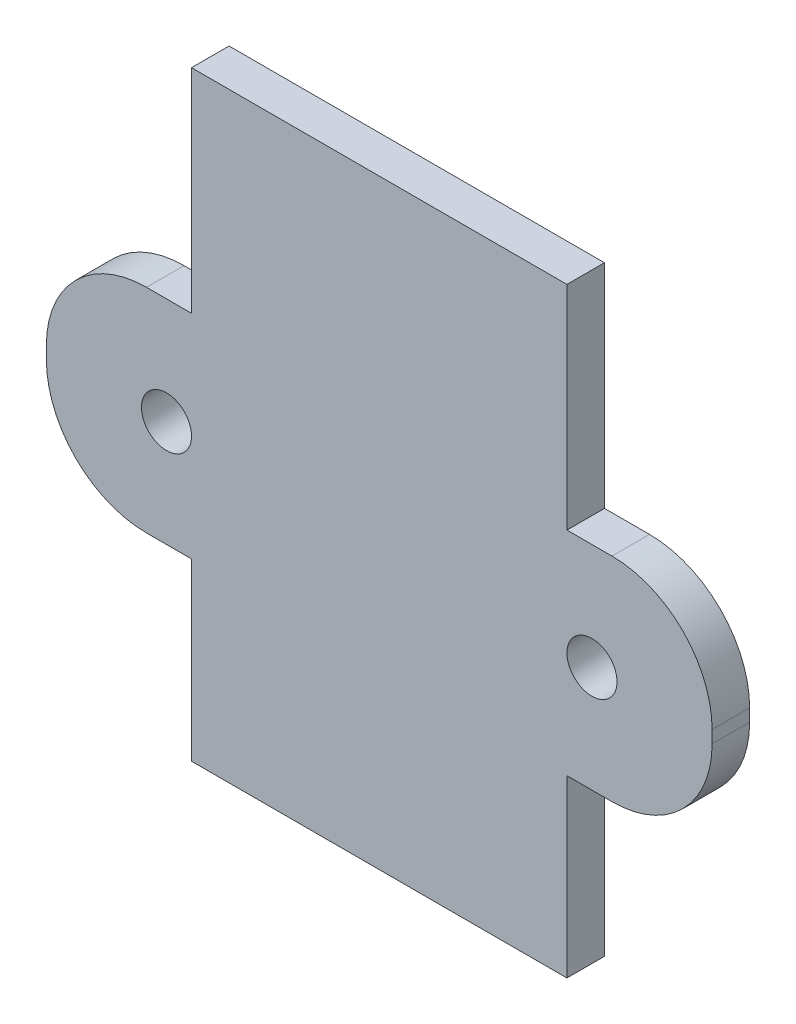
from build123d import *

# Parameters (mm, degrees)
ESBO_O2_W                = 28.244172386
ESBO_O2_H                = 13.944205314
RESSALTO_EXTRUS_O1_DEPTH = 2.54
ESBO_O3_R                = 1
RESSALTO_EXTRUS_O2_DEPTH = 1.5
ESBO_O4_W                = 28.244172386
ESBO_O4_H                = 13.944205314
CORTE_EXTRUS_O1_DEPTH    = 2.54


with BuildPart() as part:
    # Esboço2 → Ressalto-extrusão1 (new body)
    with BuildSketch(Plane.XY):
        Rectangle(ESBO_O2_W, ESBO_O2_H)
    extrude(amount=RESSALTO_EXTRUS_O1_DEPTH)

    # Esboço4 → Corte-extrusão1 (cut)
    with BuildSketch(Plane.XY.offset(2.54)):
        Rectangle(ESBO_O4_W, ESBO_O4_H)
    extrude(amount=-CORTE_EXTRUS_O1_DEPTH, mode=Mode.SUBTRACT)


with BuildPart() as body_2:
    # Esboço3 → Ressalto-extrusão2 (new body)
    with BuildSketch(Plane.XY):
        with BuildLine():
            Line((-40.638175932, 11.952156585), (-40.638175932, 3.452156585))
            Line((-40.638175932, 3.452156585), (-42.438175932, 3.452156585))
            ThreePointArc((-42.438175932, 3.452156585), (-45.266603057, 2.28058371), (-46.438175932, -0.547843415))
            Line((-46.438175932, -0.547843415), (-46.438175932, -1.047843415))
            ThreePointArc((-46.438175932, -1.047843415), (-45.266603057, -3.876270539), (-42.438175932, -5.047843415))
            Line((-42.438175932, -5.047843415), (-40.638175932, -5.047843415))
            Line((-40.638175932, -5.047843415), (-40.638175932, -12.047843415))
            Line((-40.638175932, -12.047843415), (-25.638175932, -12.047843415))
            Line((-25.638175932, -12.047843415), (-25.638175932, -5.047843415))
            Line((-25.638175932, -5.047843415), (-23.838175932, -5.047843415))
            ThreePointArc((-23.838175932, -5.047843415), (-21.009748807, -3.876270539), (-19.838175932, -1.047843415))
            Line((-19.838175932, -1.047843415), (-19.838175932, -0.547843415))
            ThreePointArc((-19.838175932, -0.547843415), (-21.009748807, 2.28058371), (-23.838175932, 3.452156585))
            Line((-23.838175932, 3.452156585), (-25.638175932, 3.452156585))
            Line((-25.638175932, 3.452156585), (-25.638175932, 11.952156585))
            Line((-25.638175932, 11.952156585), (-40.638175932, 11.952156585))
        make_face()
        with Locations((-41.638175932, -0.797843415)):
            Circle(ESBO_O3_R, mode=Mode.SUBTRACT)
        with Locations((-24.638175932, -0.797843415)):
            Circle(ESBO_O3_R, mode=Mode.SUBTRACT)
    extrude(amount=RESSALTO_EXTRUS_O2_DEPTH)


solid = body_2.part
